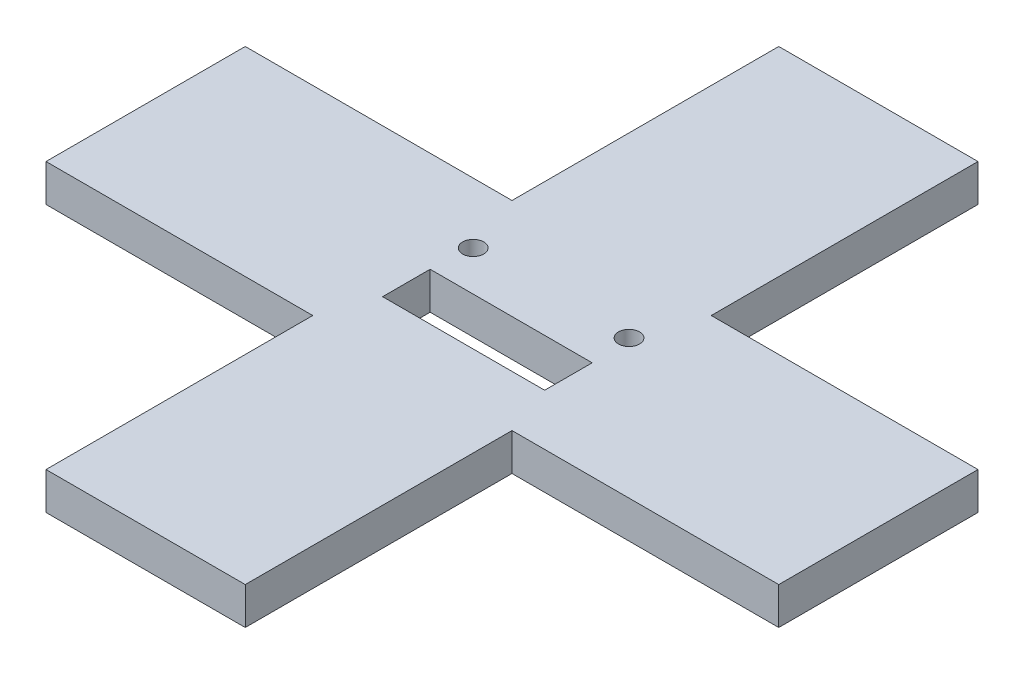
from build123d import *

# Parameters (mm, degrees)
SKETCH21_R           = 1.7
SKETCH21_W           = 26.12
SKETCH21_H           = 7.66
BOSS_EXTRUDE18_DEPTH = 6


with BuildPart() as part:
    # Sketch21 → Boss-Extrude18 (new body)
    with BuildSketch(Plane(origin=(0, 0, 0), x_dir=(1, 0, 0), z_dir=(0, 1, 0))):
        Polygon((-0.002759086, 59.199662961), (-16.062759086, 59.199662961), (-16.062759086, 16.199662961), (-59.062759086, 16.199662961), (-59.062759086, 0.139662961), (-59.062759086, -15.920337039), (-16.062759086, -15.920337039), (-16.062759086, -58.920337039), (-0.002759086, -58.920337039), (16.057240914, -58.920337039), (16.057240914, -15.920337039), (59.057240914, -15.920337039), (59.057240914, 0.139662961), (59.057240914, 16.199662961), (16.057240914, 16.199662961), (16.057240914, 59.199662961), align=None)
        with Locations(Location((-12.56, 6.44, 0), (0, 0, 270))):
            Circle(SKETCH21_R, mode=Mode.SUBTRACT)
        with Locations(Location((12.56, 6.44, 0), (0, 0, 270))):
            Circle(SKETCH21_R, mode=Mode.SUBTRACT)
        with Locations((0, -3.83)):
            Rectangle(SKETCH21_W, SKETCH21_H, mode=Mode.SUBTRACT)
    extrude(amount=BOSS_EXTRUDE18_DEPTH)


solid = part.part
